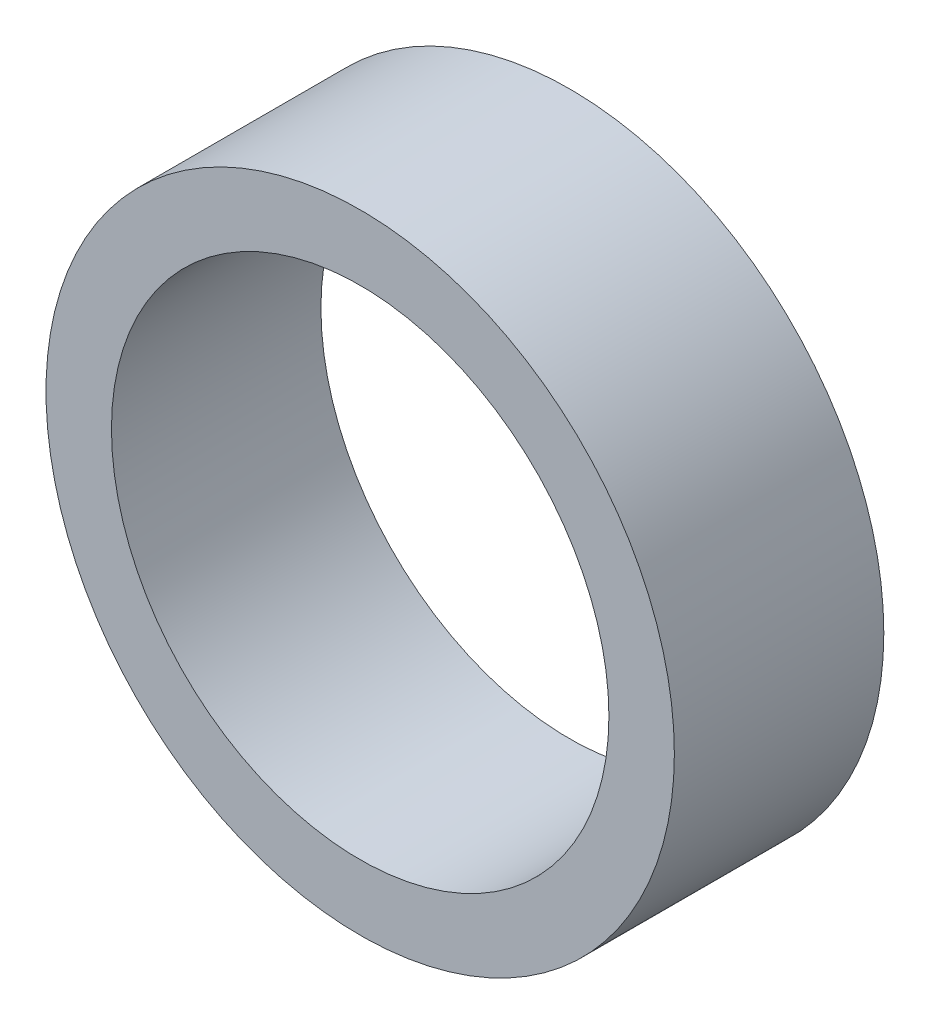
from build123d import *

# Parameters (mm, degrees)
SKETCH1_R           = 9.525
SKETCH1_R_2         = 7.540625
BOSS_EXTRUDE1_DEPTH = 3.175


with BuildPart() as part:
    # Sketch1 → Boss-Extrude1 (new, symmetric)
    with BuildSketch(Plane.XY):
        Circle(SKETCH1_R)
        Circle(SKETCH1_R_2, mode=Mode.SUBTRACT)
    extrude(amount=BOSS_EXTRUDE1_DEPTH, both=True)


solid = part.part
